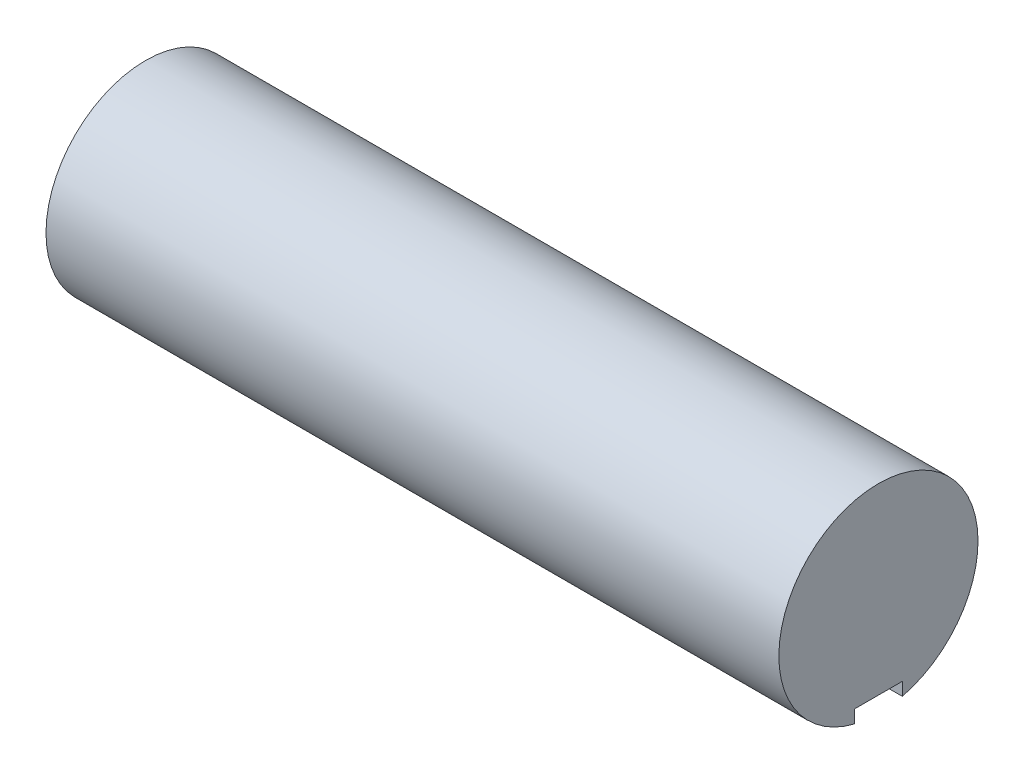
from build123d import *

# Parameters (mm, degrees)
SKETCH1_R           = 6.25
BOSS_EXTRUDE1_DEPTH = 46
SKETCH2_W           = 3
SKETCH2_H           = 2
CUT_EXTRUDE1_DEPTH  = 46


with BuildPart() as part:
    # Sketch1 → Boss-Extrude1 (new body)
    with BuildSketch(Plane(origin=(0, 0, 0), x_dir=(0, 0, -1), z_dir=(1, 0, 0))):
        Circle(SKETCH1_R)
    extrude(amount=BOSS_EXTRUDE1_DEPTH)

    # Sketch2 → Cut-Extrude1 (cut)
    with BuildSketch(Plane.ZY):
        with Locations((0, -6.25)):
            Rectangle(SKETCH2_W, SKETCH2_H)
    extrude(amount=-CUT_EXTRUDE1_DEPTH, mode=Mode.SUBTRACT)


solid = part.part
